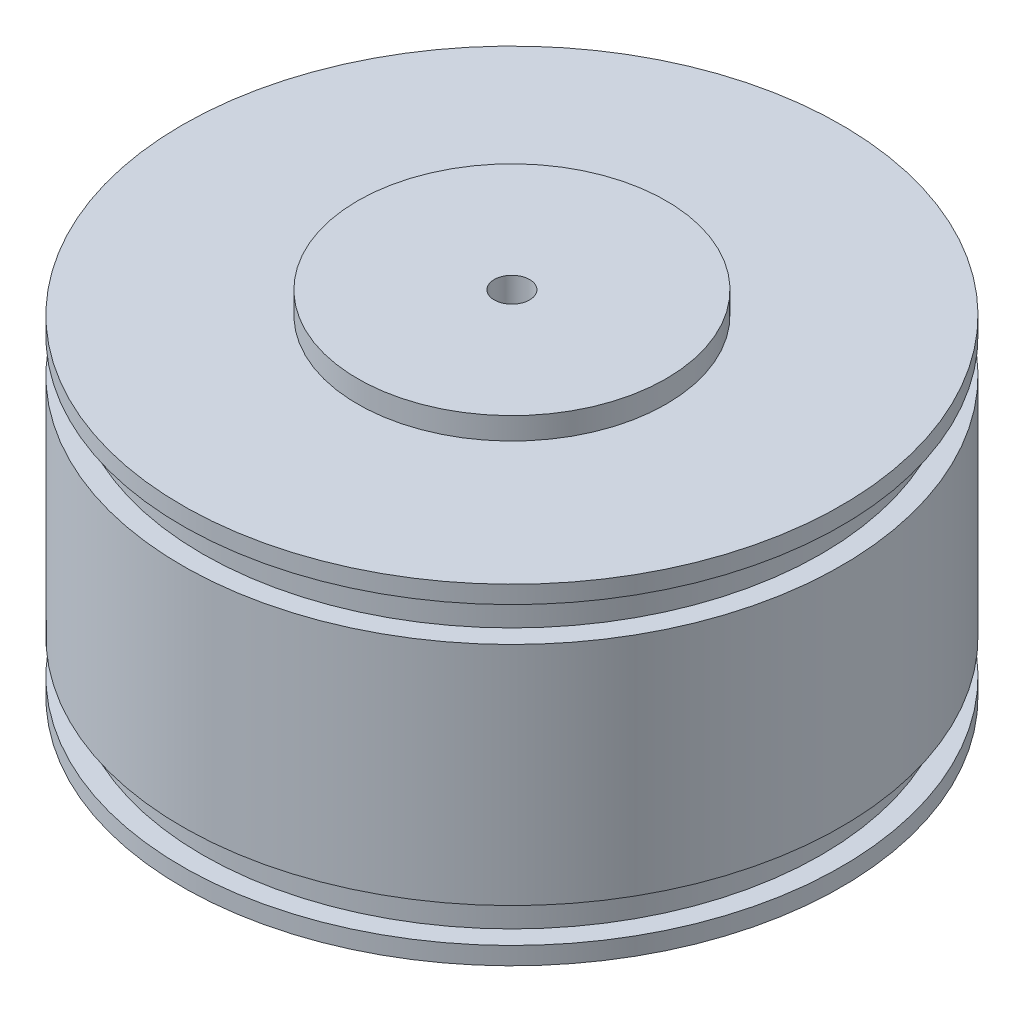
from build123d import *

# Parameters (mm, degrees)
F_1_4_20_TAPPED_HOLE1_D     = 5.1054
F_1_4_20_TAPPED_HOLE1_DEPTH = 8.118183098
F_1_4_20_TAPPED_HOLE1_TIP   = 1.533816902


with BuildPart() as part:
    # Sketch1 → Revolve1 (revolve)
    with BuildSketch(Plane.XY, mode=Mode.PRIVATE) as revolve1_sk:
        Polygon((0, 0), (22.225, 0), (22.225, -3.175), (47.498, -3.175), (47.498, -5.715), (44.577, -5.715), (44.577, -10.6934), (47.498, -10.6934), (47.498, -28.7782), (47.498, -33.7566), (47.498, -43.2816), (44.577, -43.2816), (44.577, -48.26), (47.498, -48.26), (47.498, -50.8), (41.148, -50.8), (41.148, -12.7), (0, -12.7), align=None)
    revolve(revolve1_sk.sketch.rotate(Axis((0, 38.901080227, 0), (0, -1, 0)), 180), axis=Axis((0, 38.901080227, 0), (0, -1, 0)))

    # 1/4-20 Tapped Hole1
    with Locations(Plane(origin=(0, 0, 0), x_dir=(1, 0, 0), z_dir=(0, 1, 0))):
        with Locations((0, 0)):
            Hole(F_1_4_20_TAPPED_HOLE1_D / 2, depth=F_1_4_20_TAPPED_HOLE1_DEPTH)
            with Locations((0, 0, -(F_1_4_20_TAPPED_HOLE1_DEPTH + F_1_4_20_TAPPED_HOLE1_TIP / 2))):  # 118° drill point
                Cone(0, F_1_4_20_TAPPED_HOLE1_D / 2, F_1_4_20_TAPPED_HOLE1_TIP, mode=Mode.SUBTRACT)


solid = part.part
